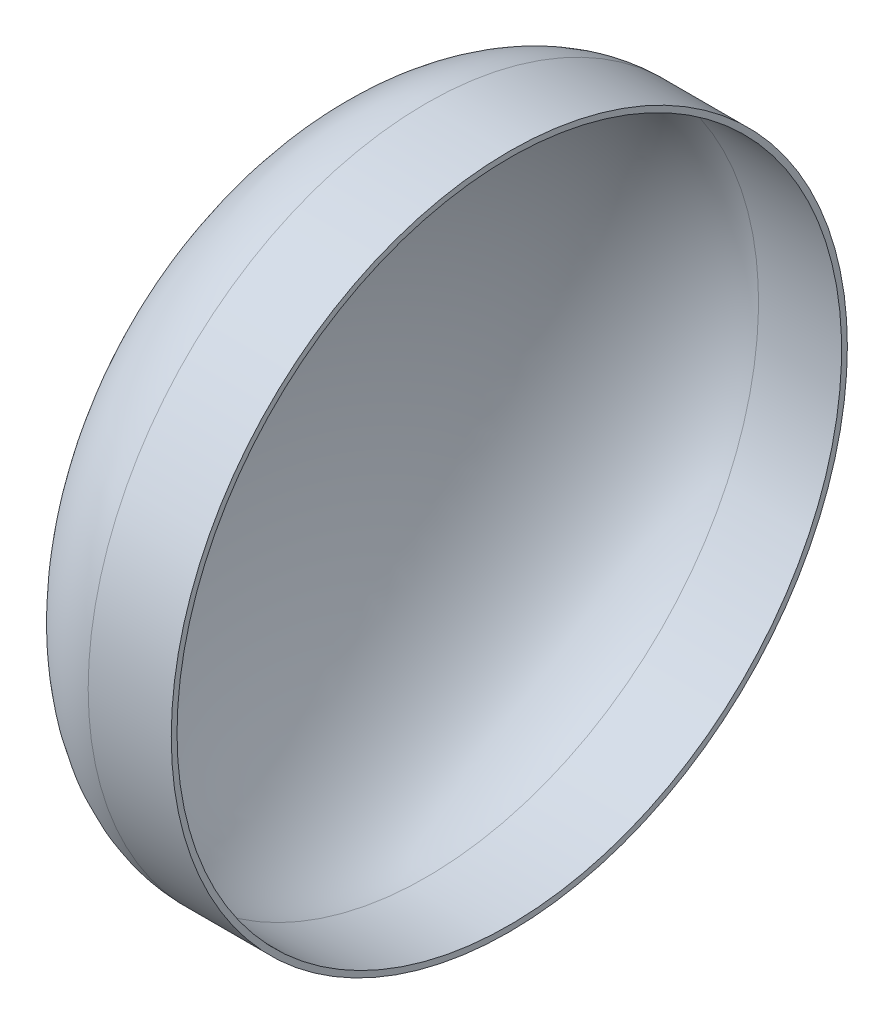
from build123d import *

# Parameters (mm, degrees)
SHELL_2_T = 2


with BuildPart() as part:
    # Эскиз1 → Повернуть2 (revolve)
    with BuildSketch(Plane.XY, mode=Mode.PRIVATE) as revolve_2_sk:
        with BuildLine():
            Line((-57.5, 0), (28.75, 0))
            Line((28.75, 0), (28.75, 115))
            Line((28.75, 115), (0, 115))
            add(Edge.make_bspline(
                [(0, 115), (-57.5, 115), (-57.5, 0)],
                knots=[3.141592654, 3.141592654, 3.141592654, 4.71238898, 4.71238898, 4.71238898], degree=2, weights=[1, 0.707106781, 1]))
        make_face()
    revolve(revolve_2_sk.sketch.rotate(Axis((-57.5, 0, 0), (1, 0, 0)), 90), axis=Axis((-57.5, 0, 0), (1, 0, 0)))

    # Оболочка2
    shell_2_openings = [part.faces().sort_by_distance(p)[0] for p in [
        (28.75, 0, 0),
    ]]
    offset(amount=SHELL_2_T, openings=shell_2_openings, kind=Kind.INTERSECTION)


solid = part.part
